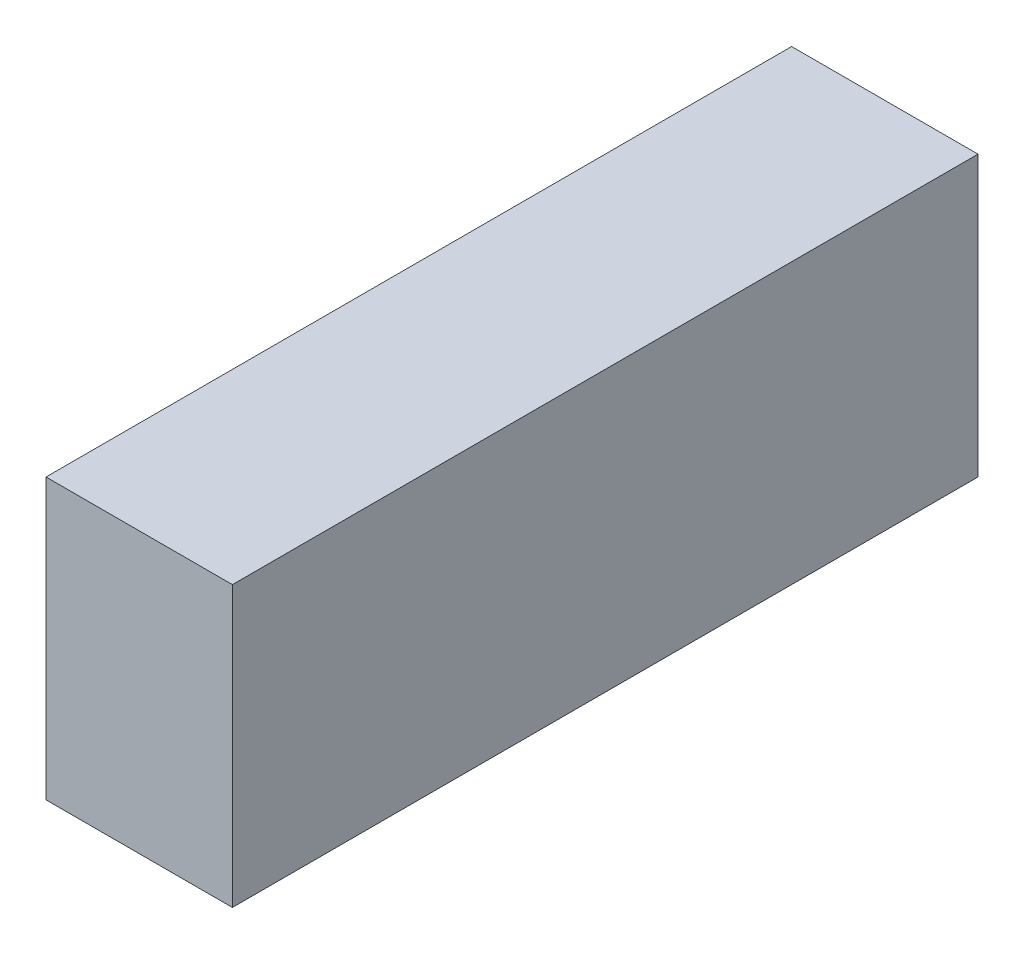
from build123d import *

# Parameters (mm, degrees)
CEK_1L_KAYIS_BAGLANTI_PABUCU_1_START = -40
SKETCH1_W                            = 10
SKETCH1_H                            = 15
CEK_1L_KAYIS_BAGLANTI_PABUCU_1_DEPTH = 40


with BuildPart() as part:
    # Sketch1 → CEK_1L_kayis_baglanti_pabucu_1 (new body)
    with BuildSketch(Plane.XY.offset(CEK_1L_KAYIS_BAGLANTI_PABUCU_1_START)):
        with Locations((7, 36.5)):
            Rectangle(SKETCH1_W, SKETCH1_H)
    extrude(amount=-CEK_1L_KAYIS_BAGLANTI_PABUCU_1_DEPTH)


solid = part.part
